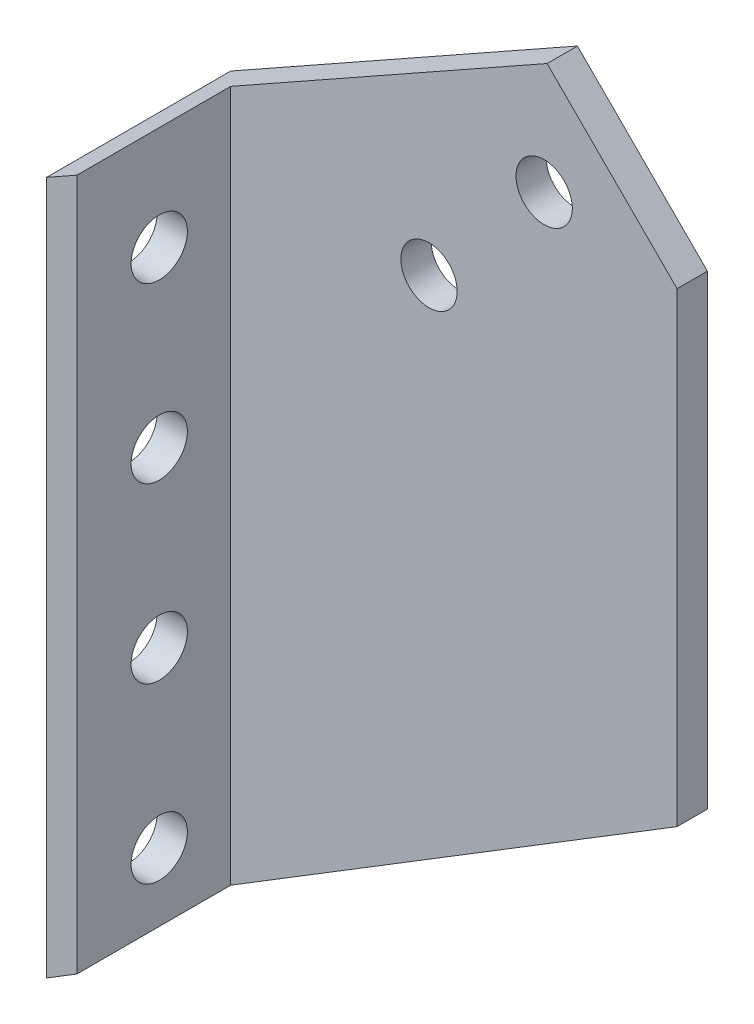
from build123d import *

# Parameters (mm, degrees)
SKETCH_1_R             = 13
EXTRUDE_1_DEPTH        = 14
EXTRUDE_2_DEPTH        = 71
SKETCH_5_R             = 13
CUT_EXTRUDE_3_DEPTH    = 420.252591423
PATTERN_LINEAR_1_COUNT = 4
PATTERN_LINEAR_1_PITCH = 80


with BuildPart() as part:
    # 草图1 → 凸台-拉伸1 (new body)
    with BuildSketch(Plane.XY):
        Polygon((-119.656440364, -63.376666372), (-119.656440364, 256.623333628), (40.343559636, 346.623333628), (100.343559636, 286.623333628), (100.343559636, 71.623333628), align=None)
        with Locations((-14.156440364, 234.748333628)):
            Circle(SKETCH_1_R, mode=Mode.SUBTRACT)
        with Locations((38.992666743, 294.541079122)):
            Circle(SKETCH_1_R, mode=Mode.SUBTRACT)
    extrude(amount=EXTRUDE_1_DEPTH)

    # 草图3 → 凸台-拉伸2 (add)
    with BuildSketch(Plane.XY.offset(14)):
        Polygon((-105.656440364, 264.498333628), (-105.656440364, -54.785757281), (-119.656440364, -63.376666372), (-119.656440364, 256.623333628), align=None)
    extrude(amount=EXTRUDE_2_DEPTH)

    # 草图5 → 切除-拉伸3 (cut, through all)
    with BuildSketch(Plane.ZY.offset(119.656440364)):
        with Locations(Location((47, 216.623333628, 0), (0, 0, 270))):
            Circle(SKETCH_5_R)
    cut_extrude_3 = extrude(amount=-CUT_EXTRUDE_3_DEPTH, mode=Mode.SUBTRACT)

    # 阵列(线性)1: 切除-拉伸3 ×4
    with Locations(*[(0, -i * PATTERN_LINEAR_1_PITCH, 0) for i in range(1, PATTERN_LINEAR_1_COUNT)]):
        add(cut_extrude_3, mode=Mode.SUBTRACT)


solid = part.part
